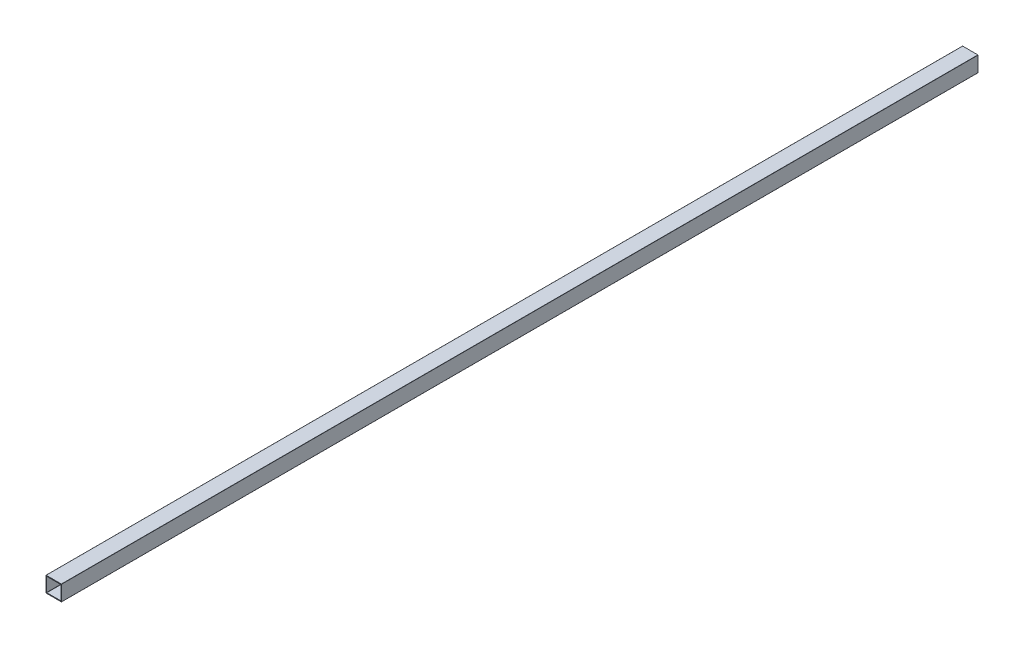
from build123d import *

# Parameters (mm, degrees)
CROQUIS1_W              = 101.6
CROQUIS1_H              = 101.6
CROQUIS1_W_2            = 92.5
CROQUIS1_H_2            = 92.5
SALIENTE_EXTRUIR1_DEPTH = 6000
REDONDEO1_R             = 1


with BuildPart() as part:
    # Croquis1 → Saliente-Extruir1 (new body)
    with BuildSketch(Plane.XY):
        Rectangle(CROQUIS1_W, CROQUIS1_H)
        Rectangle(CROQUIS1_W_2, CROQUIS1_H_2, mode=Mode.SUBTRACT)
    extrude(amount=-SALIENTE_EXTRUIR1_DEPTH)

    # Redondeo1
    redondeo1_edges = [part.edges().sort_by_distance(p)[0] for p in [
        (46.25, -46.25, -3000),
        (-46.25, -46.25, -3000),
        (-46.25, 46.25, -3000),
        (46.25, 46.25, -3000),
        (50.8, -50.8, -3000),
        (-50.8, -50.8, -3000),
        (-50.8, 50.8, -3000),
        (50.8, 50.8, -3000),
    ]]
    fillet(redondeo1_edges, radius=REDONDEO1_R)


solid = part.part
